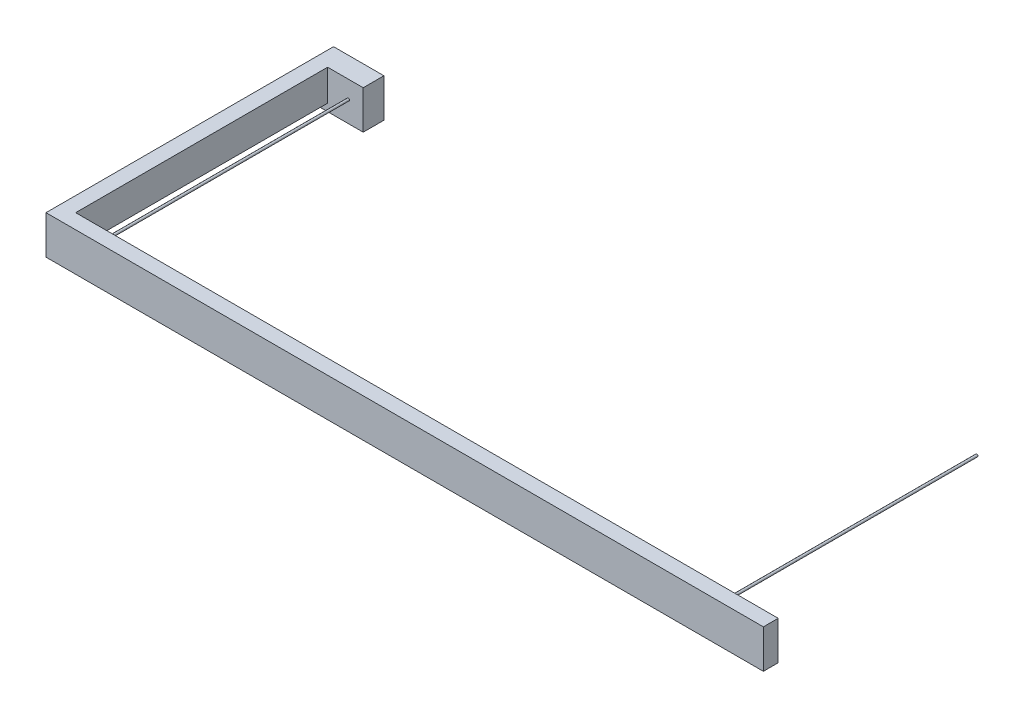
from build123d import *

# Parameters (mm, degrees)
SKETCH1_W           = 25
SKETCH1_H           = 13
BOSS_EXTRUDE1_DEPTH = 5
SKETCH2_R           = 0.4
BOSS_EXTRUDE2_DEPTH = 87
SKETCH3_W           = 5
SKETCH3_H           = 13
BOSS_EXTRUDE3_DEPTH = 210
SKETCH4_R           = 0.4
BOSS_EXTRUDE4_DEPTH = 87
SKETCH5_W           = 5
SKETCH5_H           = 13
BOSS_EXTRUDE5_DEPTH = 7
SKETCH6_W           = 5
SKETCH6_H           = 13
BOSS_EXTRUDE6_DEPTH = 92
BOSS_EXTRUDE7_START = -13
SKETCH8_W           = 12
SKETCH8_H           = 7
BOSS_EXTRUDE7_DEPTH = 13
CUT_EXTRUDE4_DEPTH  = 85


with BuildPart() as part:
    # Sketch1 → Boss-Extrude1 (new body)
    with BuildSketch(Plane.XY):
        with Locations((12.5, 6.5)):
            Rectangle(SKETCH1_W, SKETCH1_H)
    extrude(amount=BOSS_EXTRUDE1_DEPTH)

    # Sketch2 → Boss-Extrude2 (add)
    with BuildSketch(Plane(origin=(0, 0, 0), x_dir=(-1, 0, 0), z_dir=(0, 0, -1))):
        with Locations((-5, 7.1)):
            Circle(SKETCH2_R)
    extrude(amount=BOSS_EXTRUDE2_DEPTH)

    # Sketch3 → Boss-Extrude3 (add)
    with BuildSketch(Plane.ZY):
        with Locations((2.5, 6.5)):
            Rectangle(SKETCH3_W, SKETCH3_H)
    extrude(amount=BOSS_EXTRUDE3_DEPTH)

    # Sketch4 → Boss-Extrude4 (add)
    with BuildSketch(Plane(origin=(0, 0, 0), x_dir=(-1, 0, 0), z_dir=(0, 0, -1))):
        with Locations((205, 7.1)):
            Circle(SKETCH4_R)
    extrude(amount=BOSS_EXTRUDE4_DEPTH)

    # Sketch5 → Boss-Extrude5 (add)
    with BuildSketch(Plane.ZY.offset(210)):
        with Locations((2.5, 6.5)):
            Rectangle(SKETCH5_W, SKETCH5_H)
    extrude(amount=BOSS_EXTRUDE5_DEPTH)

    # Sketch6 → Boss-Extrude6 (add)
    with BuildSketch(Plane(origin=(0, 0, 0), x_dir=(-1, 0, 0), z_dir=(0, 0, -1))):
        with Locations((214.5, 6.5)):
            Rectangle(SKETCH6_W, SKETCH6_H)
    extrude(amount=BOSS_EXTRUDE6_DEPTH)

    # Sketch8 → Boss-Extrude7 (add)
    with BuildSketch(Plane.XZ.offset(BOSS_EXTRUDE7_START)):
        with Locations((-206, -88.5)):
            Rectangle(SKETCH8_W, SKETCH8_H)
    extrude(amount=BOSS_EXTRUDE7_DEPTH)

    # Sketch12 → Cut-Extrude4 (cut)
    with BuildSketch(Plane(origin=(0, 0, 0), x_dir=(-1, 0, 0), z_dir=(0, 0, -1))):
        Polygon((204.365486279, 0), (217, 4.113001179), (217, 0), align=None)
    extrude(amount=CUT_EXTRUDE4_DEPTH, mode=Mode.SUBTRACT)


solid = part.part
